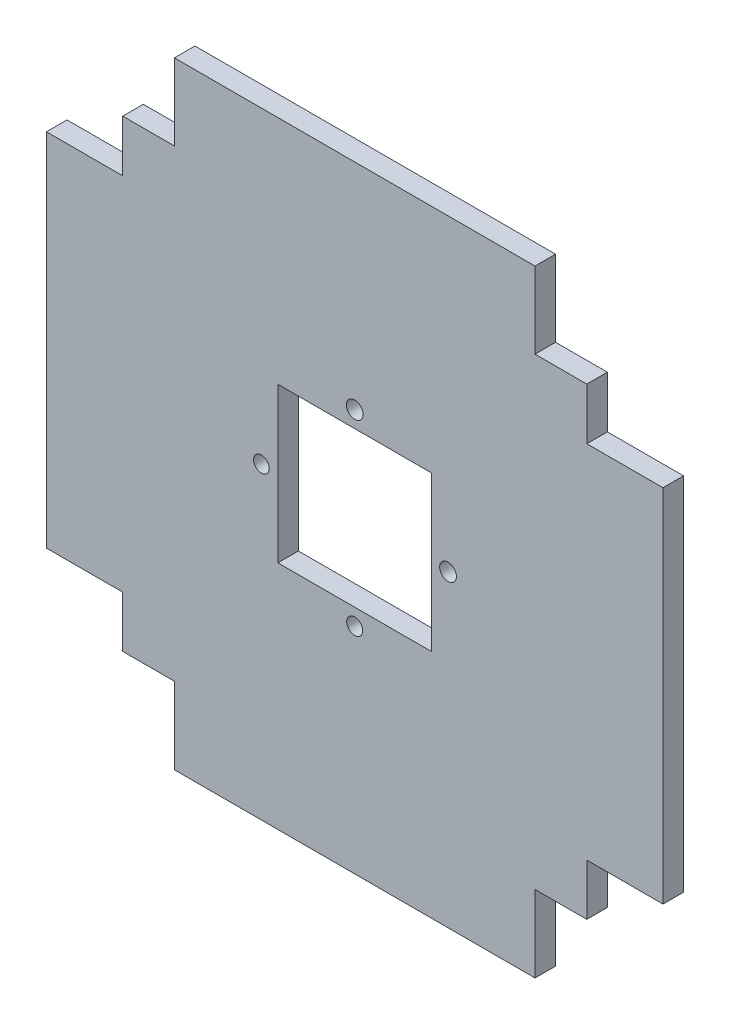
from build123d import *

# Parameters (mm, degrees)
SKETCH1_R           = 1.932130595
SKETCH1_R_2         = 2.077751344
SKETCH1_R_3         = 2.074790544
SKETCH1_R_4         = 1.977245509
SKETCH1_W           = 37.994310796
SKETCH1_H           = 38.225983422
BOSS_EXTRUDE1_DEPTH = 5.08


with BuildPart() as part:
    # Sketch1 → Boss-Extrude1 (new body)
    with BuildSketch(Plane.XY):
        Polygon((-46.541317365, 64.792814371), (42.586826347, 64.792814371), (42.586826347, 45.932934132), (55.3889879, 45.932934132), (55.3889879, 33.156886228), (74.222754491, 33.156886228), (74.222754491, -55.971257485), (55.3889879, -55.971257485), (55.3889879, -68.652333238), (42.586826347, -68.652333238), (42.586826347, -87.607185629), (-46.541317365, -87.607185629), (-46.541317365, -68.652333238), (-59.317365269, -68.652333238), (-59.317365269, -55.971257485), (-78.177245509, -55.971257485), (-78.177245509, 33.156886228), (-59.317365269, 33.156886228), (-59.317365269, 45.932934132), (-46.541317365, 45.932934132), align=None)
        with Locations((-25.038400907, -11.407185629)):
            Circle(SKETCH1_R, mode=Mode.SUBTRACT)
        with Locations((-1.977245509, 11.769806082)):
            Circle(SKETCH1_R_2, mode=Mode.SUBTRACT)
        with Locations((21.083909889, -11.407185629)):
            Circle(SKETCH1_R_3, mode=Mode.SUBTRACT)
        with Locations((-1.977245509, -34.58417734)):
            Circle(SKETCH1_R_4, mode=Mode.SUBTRACT)
        with Locations((-1.977245509, -11.407185629)):
            Rectangle(SKETCH1_W, SKETCH1_H, mode=Mode.SUBTRACT)
    extrude(amount=BOSS_EXTRUDE1_DEPTH)


solid = part.part
